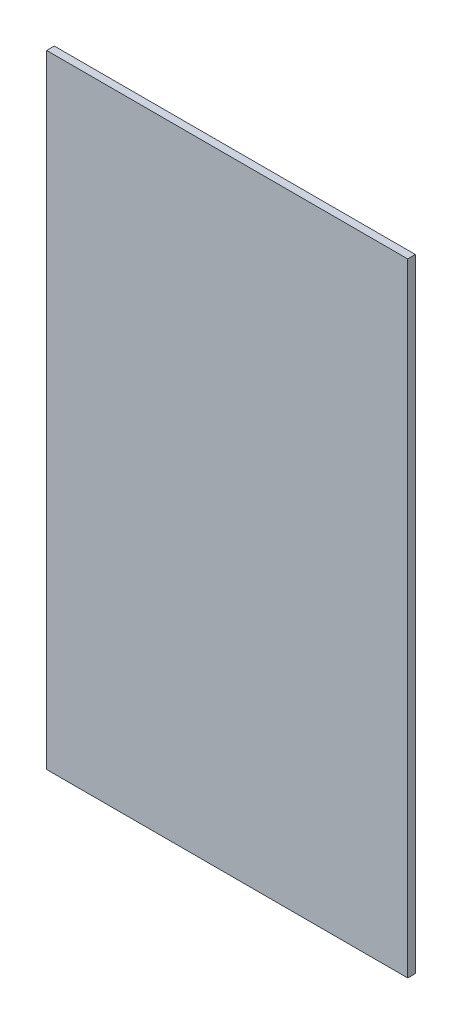
from build123d import *

# Parameters (mm, degrees)
SKETCH1_W           = 141.39
SKETCH1_H           = 243.83
BOSS_EXTRUDE1_DEPTH = 3


with BuildPart() as part:
    # Sketch1 → Boss-Extrude1 (new body)
    with BuildSketch(Plane.XY):
        with Locations((70.695, 121.915)):
            Rectangle(SKETCH1_W, SKETCH1_H)
    extrude(amount=BOSS_EXTRUDE1_DEPTH)


solid = part.part
